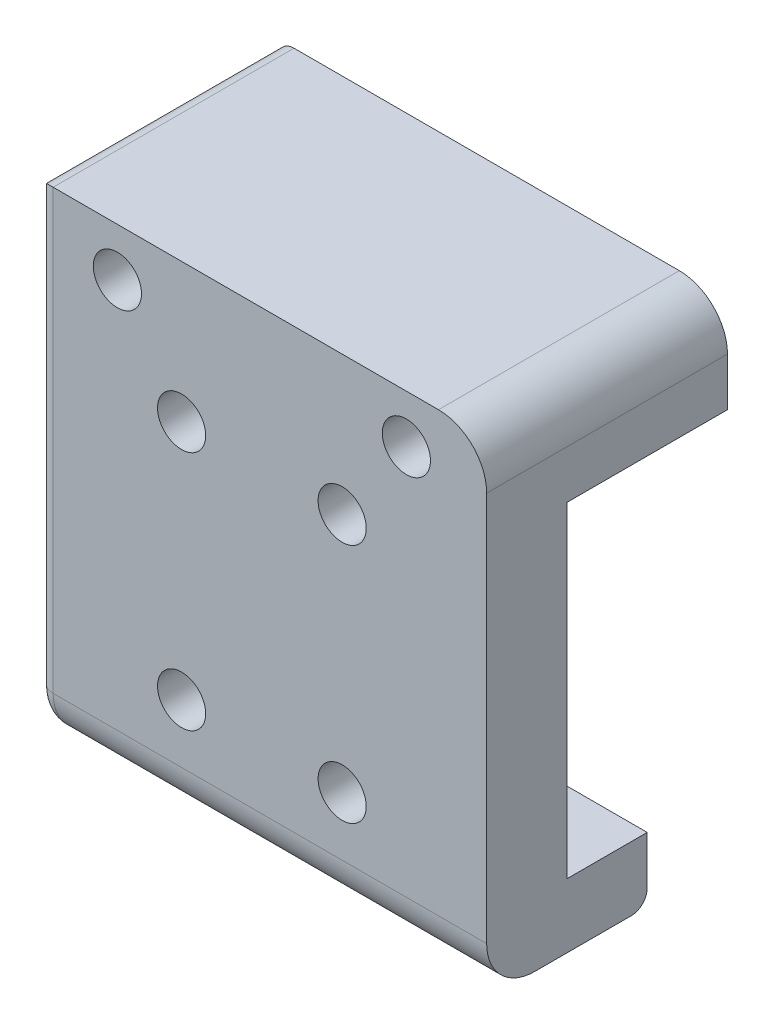
from build123d import *

# Parameters (mm, degrees)
SKETCH_1_W          = 28
SKETCH_1_H          = 20.3
SKETCH_1_R          = 1.5
EXTRUDE_1_DEPTH     = 5
SKETCH_2_W          = 28
SKETCH_2_H          = 6
SKETCH_2_H_2        = 4
EXTRUDE_2_DEPTH     = 10
SKETCH_3_W          = 28
SKETCH_3_H          = 6
EXTRUDE_3_DEPTH     = 5
FILLET_1_R          = 3
FILLET_2_R          = 1
SKETCH_4_R          = 1.5
CUT_EXTRUDE_1_DEPTH = 27.11173108


with BuildPart() as part:
    # 草图1 → 凸台-拉伸1 (new body)
    with BuildSketch(Plane.XY):
        Rectangle(SKETCH_1_W, SKETCH_1_H)
        with Locations((-5, 7.5)):
            Circle(SKETCH_1_R, mode=Mode.SUBTRACT)
        with Locations((5, 7.5)):
            Circle(SKETCH_1_R, mode=Mode.SUBTRACT)
        with Locations((5, -7.5)):
            Circle(SKETCH_1_R, mode=Mode.SUBTRACT)
        with Locations((-5, -7.5)):
            Circle(SKETCH_1_R, mode=Mode.SUBTRACT)
    extrude(amount=EXTRUDE_1_DEPTH)

    # 草图2 → 凸台-拉伸2 (add)
    with BuildSketch(Plane.XY.offset(5)):
        with Locations((0, 13.15)):
            Rectangle(SKETCH_2_W, SKETCH_2_H)
        with Locations((0, -12.15)):
            Rectangle(SKETCH_2_W, SKETCH_2_H_2)
    extrude(amount=-EXTRUDE_2_DEPTH)

    # 草图3 → 凸台-拉伸3 (add)
    with BuildSketch(Plane(origin=(0, 0, -5), x_dir=(-1, 0, 0), z_dir=(0, 0, -1))):
        with Locations((0, 13.15)):
            Rectangle(SKETCH_3_W, SKETCH_3_H)
    extrude(amount=EXTRUDE_3_DEPTH)

    # 圆角1
    fillet_1_edges = [part.edges().sort_by_distance(p)[0] for p in [
        (14, 16.15, -2.5),
        (0, -14.15, 5),
    ]]
    fillet(fillet_1_edges, radius=FILLET_1_R)

    # 圆角2
    fillet_2_edges = [part.edges().sort_by_distance(p)[0] for p in [
        (-14, 2.5, 5),
        (-14, 16.15, -2.5),
        (0, -14.15, -5),
        (-14, -14.15, -1.5),
        (-14, -13.271320344, 4.121320344),
    ]]
    fillet(fillet_2_edges, radius=FILLET_2_R)

    # 草图4 → 切除-拉伸1 (cut, through all)
    with BuildSketch(Plane.XY.offset(5)):
        with Locations((-9, 13.15)):
            Circle(SKETCH_4_R)
        with Locations((9, 13.15)):
            Circle(SKETCH_4_R)
    extrude(amount=-CUT_EXTRUDE_1_DEPTH, mode=Mode.SUBTRACT)


solid = part.part
